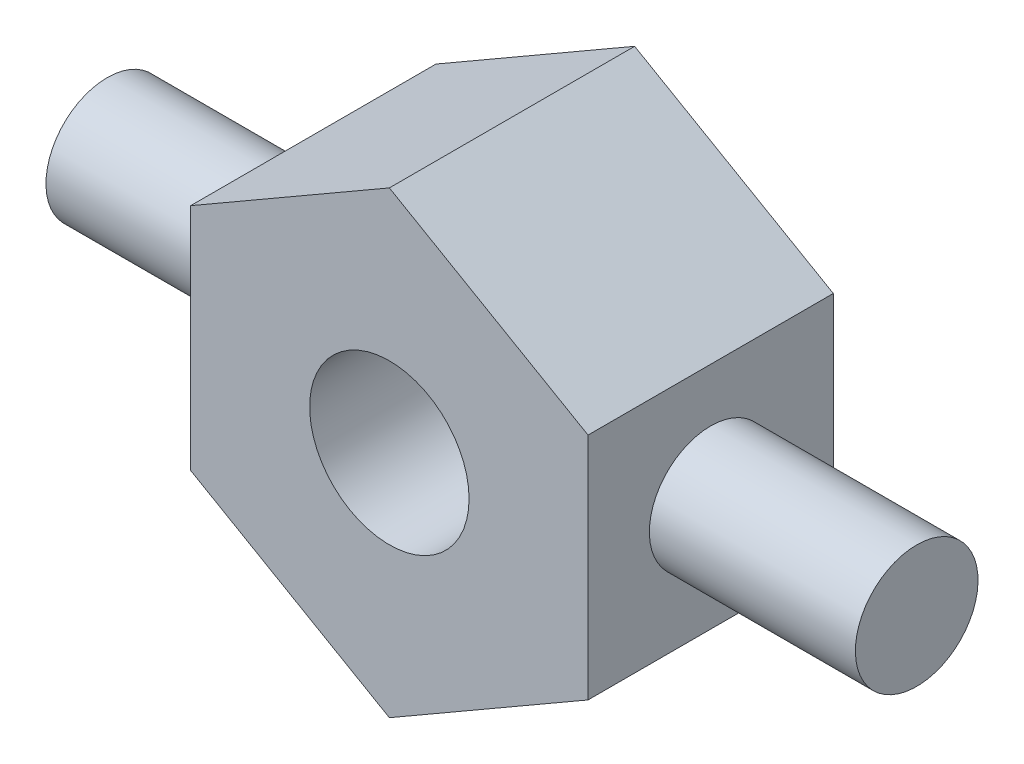
from build123d import *

# Parameters (mm, degrees)
BOSS_EXTRUDE2_DEPTH      = 50
BOSS_EXTRUDE2_DEPTH_BACK = 50
SKETCH4_W                = 330
SKETCH4_H                = 25
SKETCH5_R                = 32.5
CUT_EXTRUDE1_DEPTH       = 215.413152582


with BuildPart() as part:
    # Sketch1 → Boss-Extrude2 (new, two sides: drawn at the far end of the back side and taken through both)
    with BuildSketch(Plane.XY.offset(-BOSS_EXTRUDE2_DEPTH_BACK)):
        Polygon((0, -93.530743609), (81, -46.765371804), (81, 46.765371804), (0, 93.530743609), (-81, 46.765371804), (-81, -46.765371804), align=None)
    extrude(amount=BOSS_EXTRUDE2_DEPTH + BOSS_EXTRUDE2_DEPTH_BACK)

    # Sketch4 → Revolve2 (revolve)
    with BuildSketch(Plane.XY):
        with Locations((0, 12.5)):
            Rectangle(SKETCH4_W, SKETCH4_H)
    revolve(axis=Axis((165, 0, 0), (-1, 0, 0)))

    # Sketch5 → Cut-Extrude1 (cut, through all)
    with BuildSketch(Plane.XY.offset(50)):
        Circle(SKETCH5_R)
    extrude(amount=-CUT_EXTRUDE1_DEPTH, mode=Mode.SUBTRACT)


solid = part.part
